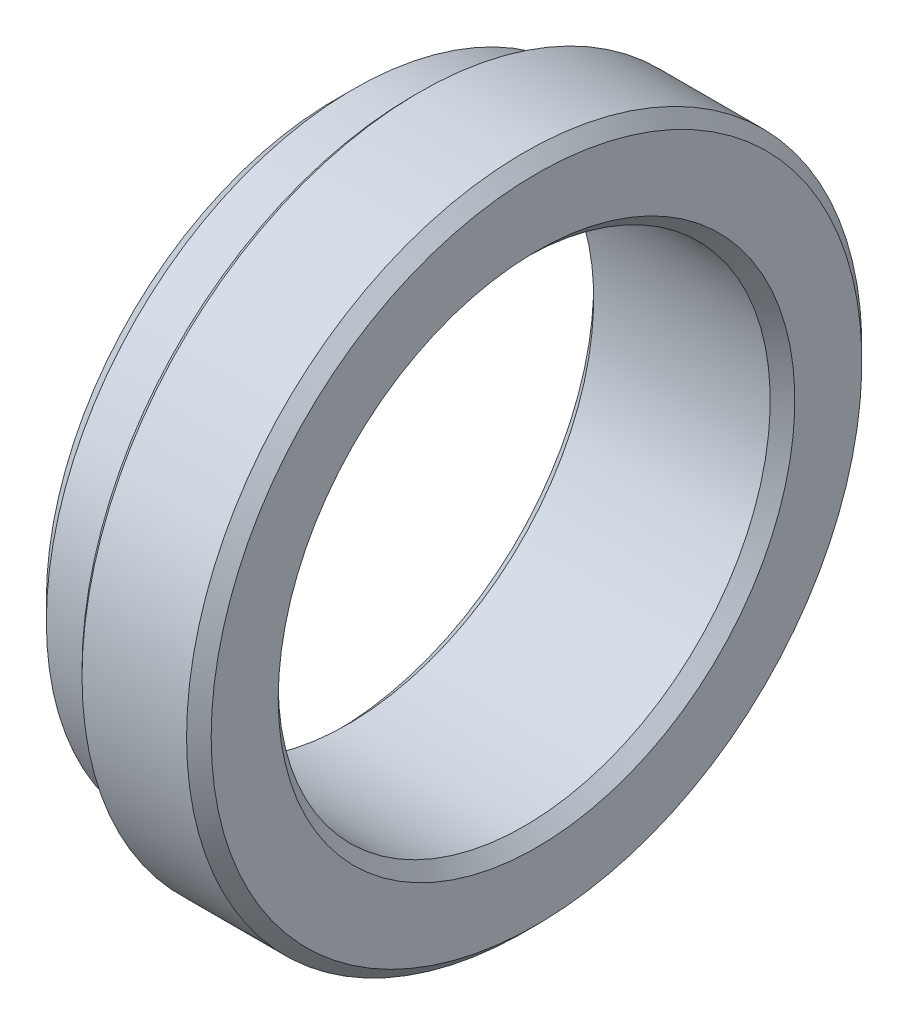
from build123d import *


with BuildPart() as part:
    # Croquis2 → Revolución1 (revolve)
    with BuildSketch(Plane.XY, mode=Mode.PRIVATE) as revoluci_n1_sk:
        with BuildLine():
            Line((0, 23.5), (0, 21))
            Line((0, 21), (1, 20))
            Line((1, 20), (15.35, 20))
            Line((15.35, 20), (16.35, 21))
            Line((16.35, 21), (16.35, 26.45))
            Line((16.35, 26.45), (15.35, 27.45))
            Line((15.35, 27.45), (6.85, 27.45))
            Line((6.85, 27.45), (6.35, 26.95))
            Line((6.35, 26.95), (6.35, 25))
            ThreePointArc((6.35, 25), (5.85, 24.5), (5.35, 25))
            Line((5.35, 25), (1.5, 25))
            Line((1.5, 25), (0, 23.5))
        make_face()
    revolve(revoluci_n1_sk.sketch.rotate(Axis((0, 0, 0), (1, 0, 0)), 90), axis=Axis((0, 0, 0), (1, 0, 0)))


solid = part.part
